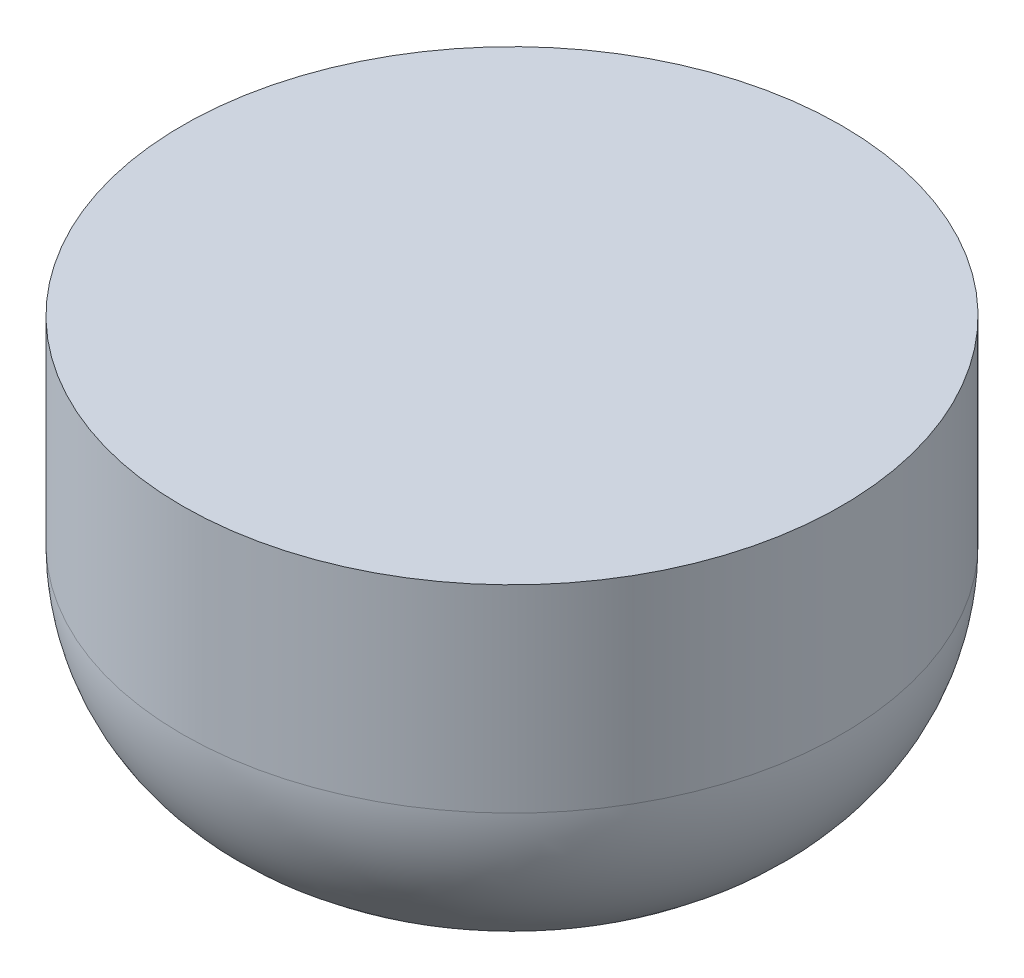
from build123d import *

# Parameters (mm, degrees)
SKETCH2_R           = 2.5
BOSS_EXTRUDE1_DEPTH = 3
FILLET1_R           = 1.5


with BuildPart() as part:
    # Sketch2 → Boss-Extrude1 (new body)
    with BuildSketch(Plane(origin=(0, 0, 0), x_dir=(1, 0, 0), z_dir=(0, 1, 0))):
        with Locations(Location((0, 0, 0), (0, 0, 270))):
            Circle(SKETCH2_R)
    extrude(amount=BOSS_EXTRUDE1_DEPTH)

    # Fillet1
    fillet1_edges = [part.edges().sort_by_distance(p)[0] for p in [
        (0, 0, -2.5),
    ]]
    fillet(fillet1_edges, radius=FILLET1_R)


solid = part.part
